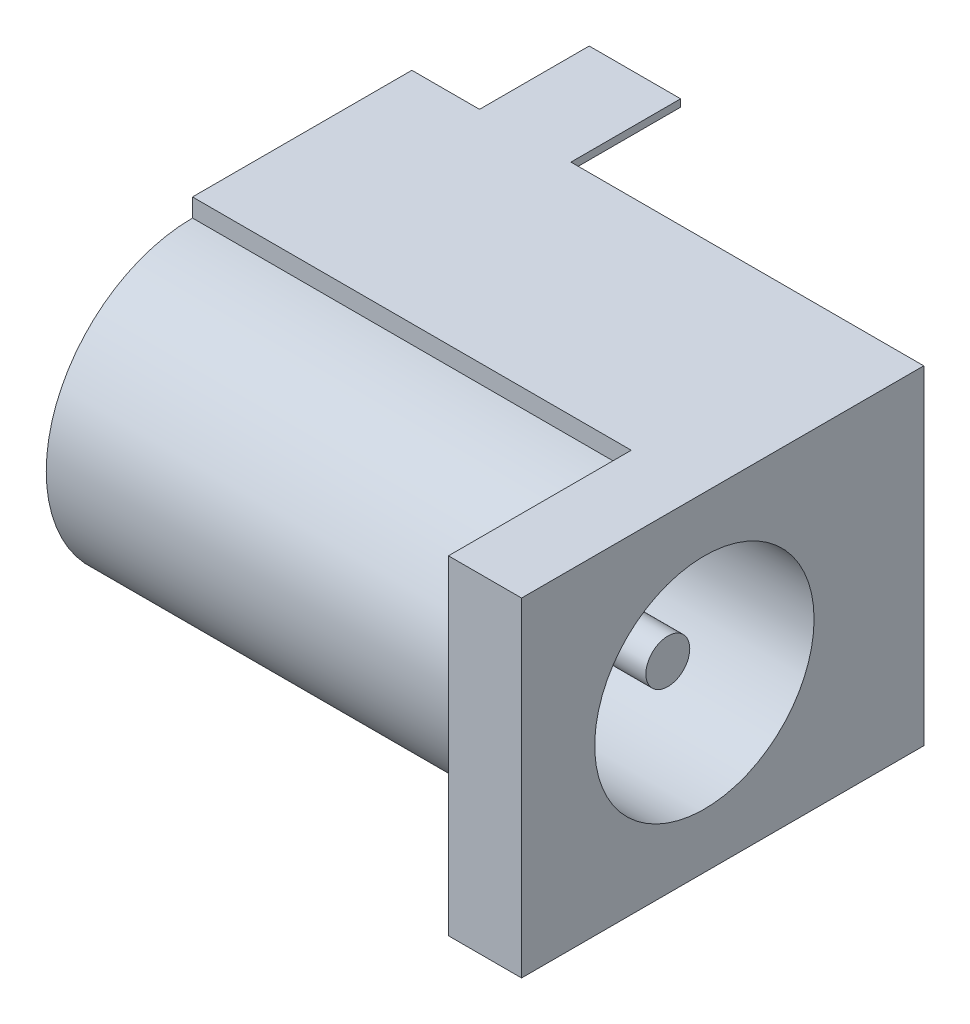
from build123d import *

# Parameters (mm, degrees)
SKETCH_1_W          = 14
SKETCH_1_H          = 9
EXTRUDE_1_DEPTH     = 11
SKETCH_3_R          = 3
CUT_EXTRUDE_1_DEPTH = 8
SKETCH_5_R          = 0.6
EXTRUDE_2_DEPTH     = 7
CUT_EXTRUDE_2_DEPTH = 12
SKETCH_7_W          = 0.2
SKETCH_7_H          = 3
SKETCH_7_H_2        = 2.5
SKETCH_7_W_2        = 2.5
SKETCH_7_H_3        = 0.2
EXTRUDE_3_DEPTH     = 3


with BuildPart() as part:
    # 草图1 → 凸台-拉伸1 (new body)
    with BuildSketch(Plane.XY):
        Rectangle(SKETCH_1_W, SKETCH_1_H)
    extrude(amount=EXTRUDE_1_DEPTH)

    # 草图3 → 切除-拉伸1 (cut)
    with BuildSketch(Plane(origin=(7, 0, 0), x_dir=(0, 0, -1), z_dir=(1, 0, 0))):
        with Locations((-6, 0)):
            Circle(SKETCH_3_R)
    extrude(amount=-CUT_EXTRUDE_1_DEPTH, mode=Mode.SUBTRACT)

    # 草图5 → 凸台-拉伸2 (add)
    with BuildSketch(Plane(origin=(-1, 0, 0), x_dir=(0, 0, -1), z_dir=(1, 0, 0))):
        with Locations((-6, 0)):
            Circle(SKETCH_5_R)
    extrude(amount=EXTRUDE_2_DEPTH)

    # 草图6 → 切除-拉伸2 (cut)
    with BuildSketch(Plane.ZY.offset(7)):
        with BuildLine():
            Line((6, 4), (6, 4.5))
            Line((6, 4.5), (11, 4.5))
            Line((11, 4.5), (11, -4.5))
            Line((11, -4.5), (6, -4.5))
            Line((6, -4.5), (6, -4))
            ThreePointArc((6, -4), (10, 0), (6, 4))
        make_face()
    extrude(amount=-CUT_EXTRUDE_2_DEPTH, mode=Mode.SUBTRACT)

    # 草图7 → 凸台-拉伸3 (add)
    with BuildSketch(Plane(origin=(0, 0, 0), x_dir=(-1, 0, 0), z_dir=(0, 0, -1))):
        with Locations((6.9, 0)):
            Rectangle(SKETCH_7_W, SKETCH_7_H)
        with Locations((-0.1, 0)):
            Rectangle(SKETCH_7_W, SKETCH_7_H_2)
        with Locations((3.9, 4.4)):
            Rectangle(SKETCH_7_W_2, SKETCH_7_H_3)
    extrude(amount=EXTRUDE_3_DEPTH)


solid = part.part
